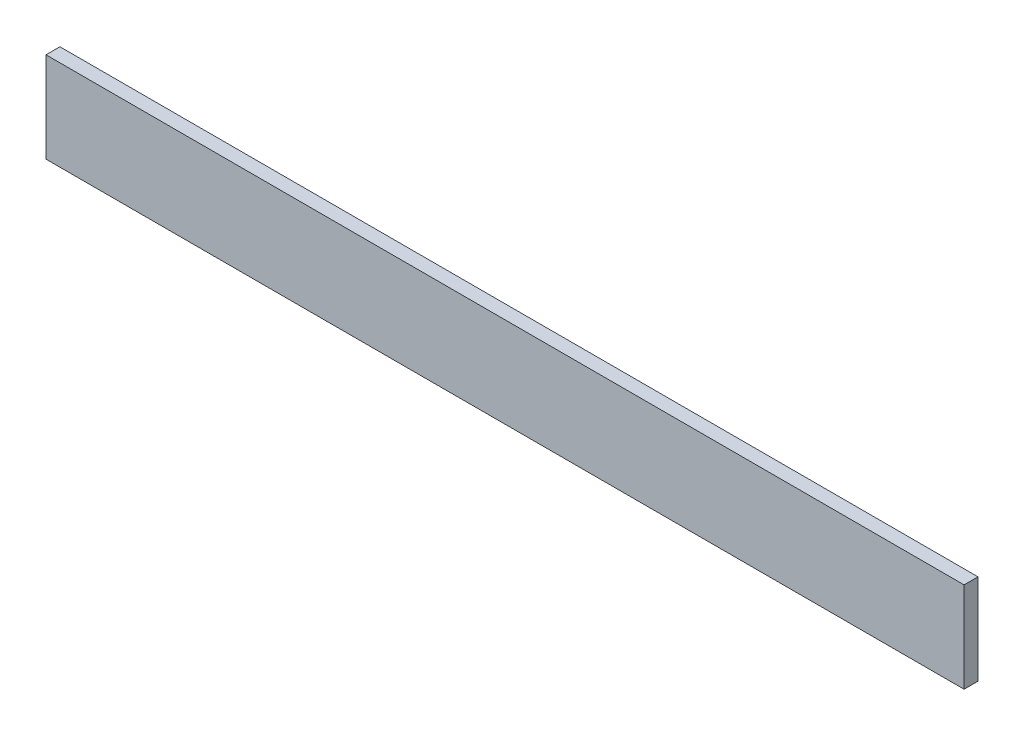
from build123d import *

# Parameters (mm, degrees)
CROQUIS1_W              = 1320
CROQUIS1_H              = 130
SALIENTE_EXTRUIR1_DEPTH = 20


with BuildPart() as part:
    # Croquis1 → Saliente-Extruir1 (new body)
    with BuildSketch(Plane.XY):
        Rectangle(CROQUIS1_W, CROQUIS1_H)
    extrude(amount=SALIENTE_EXTRUIR1_DEPTH)


solid = part.part
